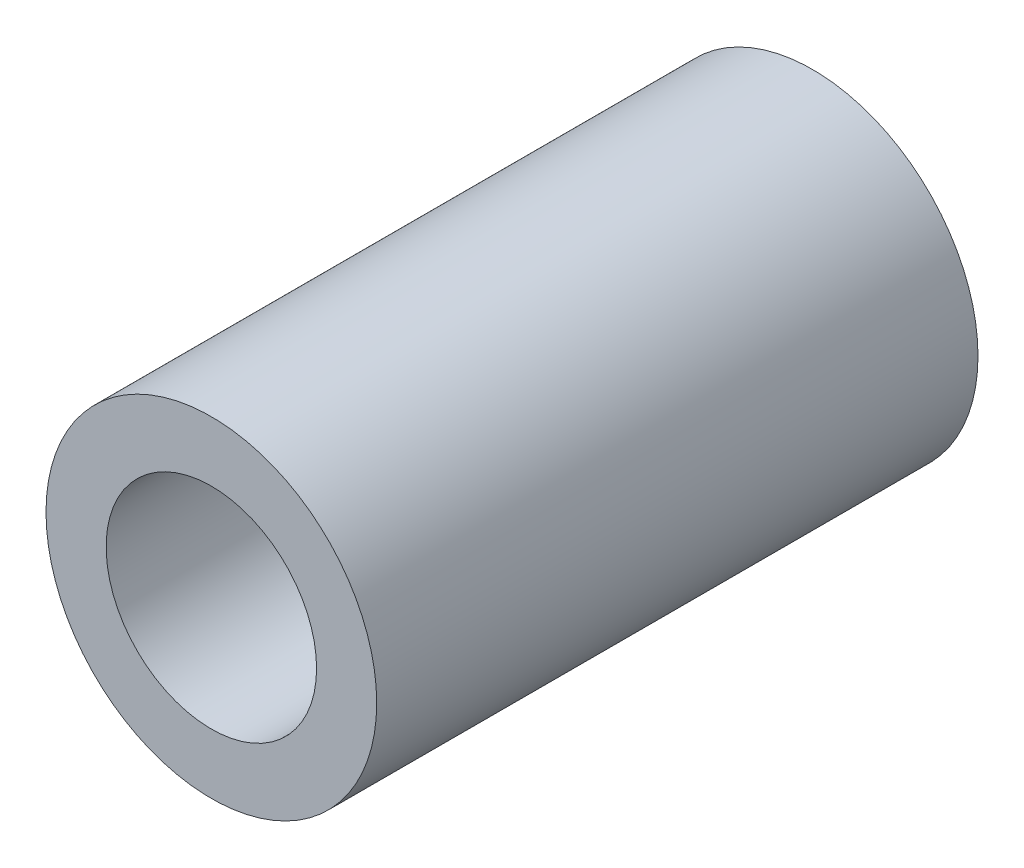
from build123d import *

# Parameters (mm, degrees)
SKETCH1_R           = 5.5
SKETCH1_R_2         = 2.5
BOSS_EXTRUDE1_DEPTH = 20
BOSS_EXTRUDE2_START = -17
SKETCH2_R           = 2.5
BOSS_EXTRUDE2_DEPTH = 2
SKETCH3_R           = 1
CUT_EXTRUDE1_DEPTH  = 2
SKETCH4_R           = 3.5
CUT_EXTRUDE3_DEPTH  = 15


with BuildPart() as part:
    # Sketch1 → Boss-Extrude1 (new body)
    with BuildSketch(Plane.XY):
        Circle(SKETCH1_R)
        Circle(SKETCH1_R_2, mode=Mode.SUBTRACT)
    extrude(amount=BOSS_EXTRUDE1_DEPTH)

    # Sketch2 → Boss-Extrude2 (add)
    with BuildSketch(Plane.XY.offset(20).offset(BOSS_EXTRUDE2_START)):
        Circle(SKETCH2_R)
    extrude(amount=BOSS_EXTRUDE2_DEPTH)

    # Sketch3 → Cut-Extrude1 (cut)
    with BuildSketch(Plane.XY.offset(5)):
        Circle(SKETCH3_R)
    extrude(amount=-CUT_EXTRUDE1_DEPTH, mode=Mode.SUBTRACT)

    # Sketch4 → Cut-Extrude3 (cut)
    with BuildSketch(Plane.XY.offset(20)):
        Circle(SKETCH4_R)
    extrude(amount=-CUT_EXTRUDE3_DEPTH, mode=Mode.SUBTRACT)


solid = part.part
